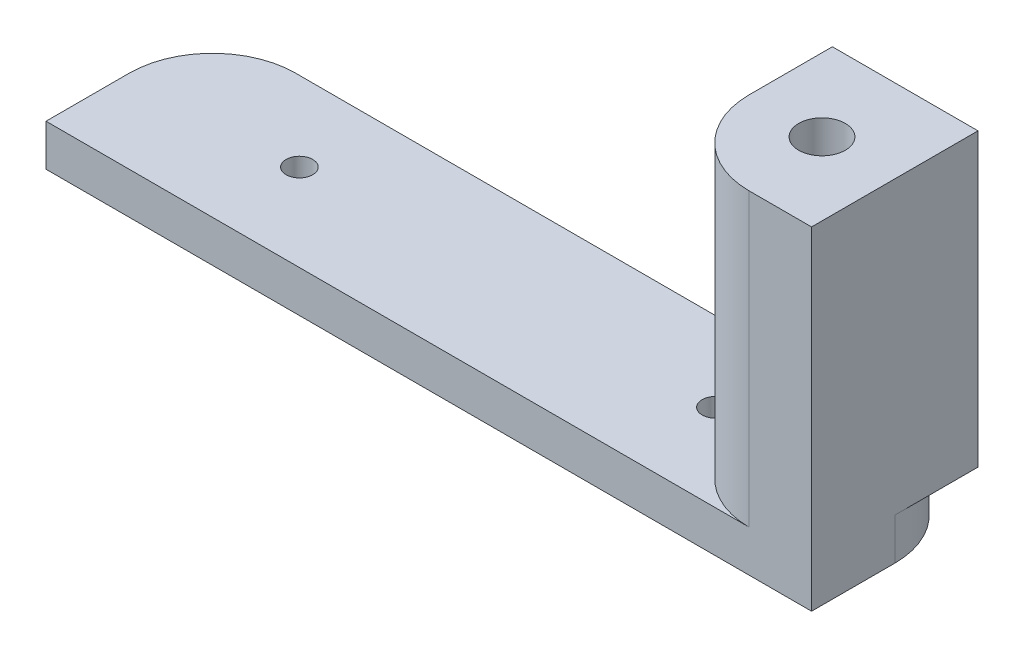
from build123d import *

# Parameters (mm, degrees)
SKETCH1_W           = 92
SKETCH1_H           = 20
BOSS_EXTRUDE1_DEPTH = 5
FILLET1_R           = 10
SKETCH2_R           = 1.6
CUT_EXTRUDE1_DEPTH  = 5
SKETCH3_W           = 17.5
SKETCH3_H           = 20
BOSS_EXTRUDE2_DEPTH = 35
SKETCH4_R           = 2.8
CUT_EXTRUDE2_DEPTH  = 45
FILLET5_R           = 10


with BuildPart() as part:
    # Sketch1 → Boss-Extrude1 (new body)
    with BuildSketch(Plane(origin=(0, 0, 0), x_dir=(1, 0, 0), z_dir=(0, 1, 0))):
        Rectangle(SKETCH1_W, SKETCH1_H)
    extrude(amount=BOSS_EXTRUDE1_DEPTH)

    # Fillet1
    fillet1_edges = [part.edges().sort_by_distance(p)[0] for p in [
        (-46, 2.5, -10),
        (46, 2.5, -10),
    ]]
    fillet(fillet1_edges, radius=FILLET1_R)

    # Sketch2 → Cut-Extrude1 (cut)
    with BuildSketch(Plane(origin=(0, 5, 0), x_dir=(1, 0, 0), z_dir=(0, 1, 0))):
        with Locations(Location((-26, 0.45, 0), (0, 0, 270))):
            Circle(SKETCH2_R)
        with Locations(Location((24, 0.45, 0), (0, 0, 270))):
            Circle(SKETCH2_R)
    extrude(amount=-CUT_EXTRUDE1_DEPTH, mode=Mode.SUBTRACT)

    # Sketch3 → Boss-Extrude2 (add)
    with BuildSketch(Plane(origin=(0, 5, 0), x_dir=(1, 0, 0), z_dir=(0, 1, 0))):
        with Locations((37.25, 0)):
            Rectangle(SKETCH3_W, SKETCH3_H)
    extrude(amount=BOSS_EXTRUDE2_DEPTH)

    # Sketch4 → Cut-Extrude2 (cut)
    with BuildSketch(Plane(origin=(0, 40, 0), x_dir=(1, 0, 0), z_dir=(0, 1, 0))):
        with Locations(Location((37.25, 0, 0), (0, 0, 270))):
            Circle(SKETCH4_R)
    extrude(amount=-CUT_EXTRUDE2_DEPTH, mode=Mode.SUBTRACT)

    # Fillet5
    fillet5_edges = [part.edges().sort_by_distance(p)[0] for p in [
        (28.5, 22.5, 10),
    ]]
    fillet(fillet5_edges, radius=FILLET5_R)


solid = part.part
